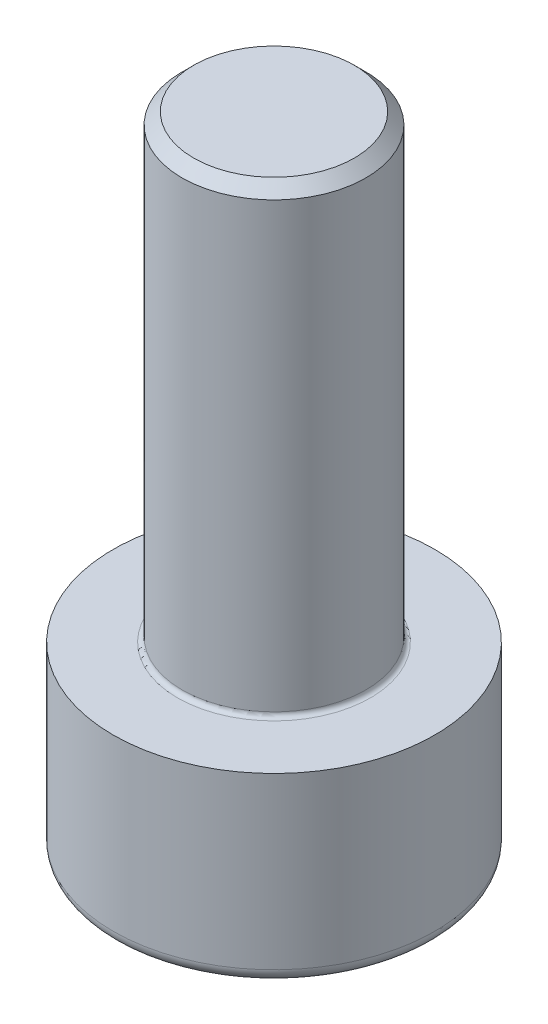
from build123d import *

# Parameters (mm, degrees)
CUT_EXTRUDE_1_REACH = 16.849


with BuildPart() as part:
    # 草图1 → 旋转1 (revolve)
    with BuildSketch(Plane.XY, mode=Mode.PRIVATE) as revolve_1_sk:
        with BuildLine():
            Line((0, 3.366025404), (0, 14))
            Line((0, 14), (1.75, 14))
            Line((1.75, 14), (2, 13.75))
            Line((2, 13.75), (2, 4.1))
            ThreePointArc((2, 4.1), (2.029289322, 4.029289322), (2.1, 4))
            Line((2.1, 4), (3.5, 4))
            Line((3.5, 4), (3.5, 0.3))
            ThreePointArc((3.5, 0.3), (3.412132034, 0.087867966), (3.2, 0))
            Line((3.2, 0), (1.5, 0))
            Line((1.5, 0), (1.5, 2.5))
            Line((1.5, 2.5), (0, 3.366025404))
        make_face()
    revolve(revolve_1_sk.sketch.rotate(Axis((0, 3.366025404, 0), (0, -1, 0)), 90), axis=Axis((0, 3.366025404, 0), (0, -1, 0)))

    # 切除-拉伸1: up to this cone (the profile starts inside it)
    cut_extrude_1_end = Plane(origin=(0, 0, 0), z_dir=(0, -1, 0)).offset(-3.366024404) * Cone(1.732e-06, 45.977552691, 26.545151423, align=(Align.CENTER, Align.CENTER, Align.MIN), mode=Mode.PRIVATE)
    # 草图2 → 切除-拉伸1 (cut, up to the surface)
    with BuildSketch(Plane.XZ, mode=Mode.PRIVATE) as cut_extrude_1_sk1:
        Polygon((1.5, -0.866025404), (1.5, 0.866025404), (0, 1.732050808), (-1.5, 0.866025404), (-1.5, -0.866025404), (0, -1.732050808), align=None)
    cut_extrude_1_tool1 = extrude(cut_extrude_1_sk1.sketch, amount=-CUT_EXTRUDE_1_REACH, mode=Mode.PRIVATE) & cut_extrude_1_end
    add(cut_extrude_1_tool1.solids().sort_by_distance((0, 0, 0))[0], mode=Mode.SUBTRACT)


solid = part.part
